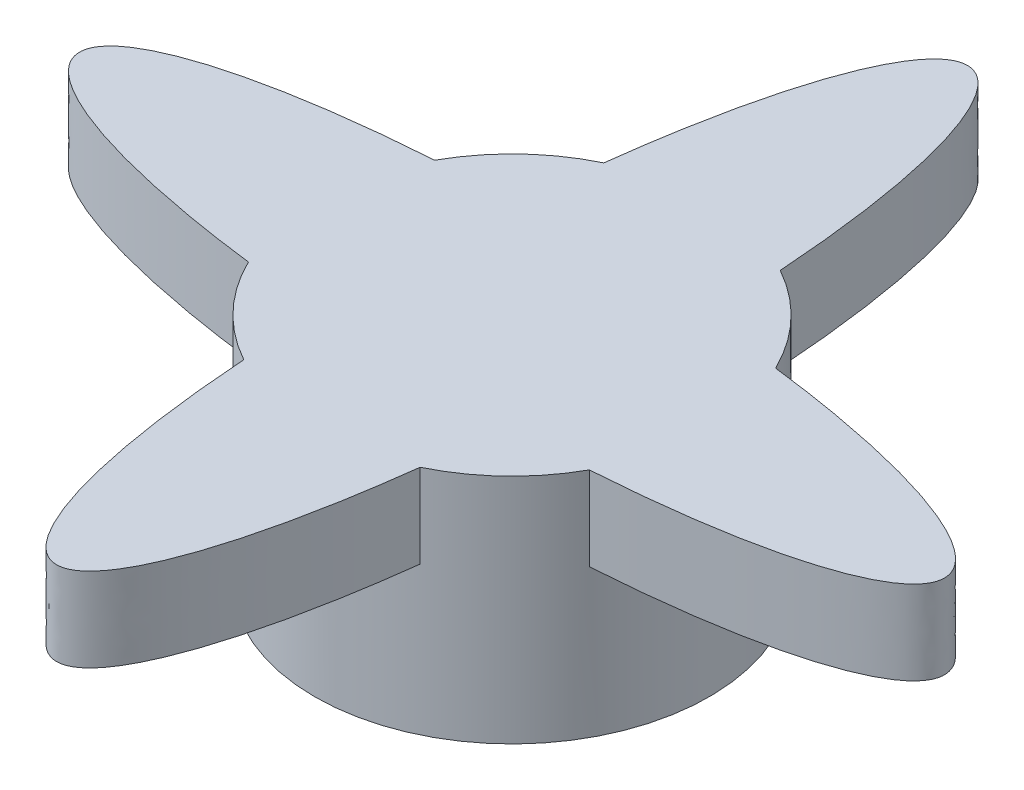
from build123d import *

# Parameters (mm, degrees)
SKETCH_1_R      = 4
SKETCH_1_R_2    = 2.5
EXTRUDE_1_DEPTH = 3
SKETCH_2_R      = 4
EXTRUDE_2_DEPTH = 1.7


with BuildPart() as part:
    # 草图1 → 凸台-拉伸1 (new body)
    with BuildSketch(Plane(origin=(0, 0, 0), x_dir=(1, 0, 0), z_dir=(0, 1, 0))):
        with Locations(Location((0, 0, 0), (0, 0, 270))):
            Circle(SKETCH_1_R)
        with Locations(Location((0, 0, 0), (0, 0, 270))):
            Circle(SKETCH_1_R_2, mode=Mode.SUBTRACT)
    extrude(amount=EXTRUDE_1_DEPTH)

    # 草图2 → 凸台-拉伸2 (add)
    with BuildSketch(Plane(origin=(0, 3, 0), x_dir=(1, 0, 0), z_dir=(0, 1, 0))):
        with BuildLine():
            ThreePointArc((3.601811154, 1.73981505), (3.899182261, 0.892399962), (4, 0))
            ThreePointArc((4, 0), (3.873348744, -0.998583752), (3.501415245, -1.933931561))
            add(Edge.make_bspline(
                [(3.501415245, -1.933931561), (22.78951803, -0.622790472), (3.601811154, 1.73981505)],
                knots=[1.976614939, 1.976614939, 1.976614939, 4.306570368, 4.306570368, 4.306570368], degree=2, weights=[1, 0.394771017, 1]))
        make_face()
        with BuildLine():
            ThreePointArc((-1.73981505, 3.601811154), (0.109270946, 3.998507204), (1.933931561, 3.501415245))
            add(Edge.make_bspline(
                [(1.933931561, 3.501415245), (0.622790472, 22.78951803), (-1.73981505, 3.601811154)],
                knots=[5.118207593, 5.118207593, 5.118207593, 7.448163021, 7.448163021, 7.448163021], degree=2, weights=[1, 0.394771017, 1]))
        make_face()
        with BuildLine():
            ThreePointArc((-3.601811154, -1.73981505), (-3.998507204, 0.109270946), (-3.501415245, 1.933931561))
            add(Edge.make_bspline(
                [(-3.501415245, 1.933931561), (-22.78951803, 0.622790472), (-3.601811154, -1.73981505)],
                knots=[5.118207593, 5.118207593, 5.118207593, 7.448163021, 7.448163021, 7.448163021], degree=2, weights=[1, 0.394771017, 1]))
        make_face()
        with BuildLine():
            add(Edge.make_bspline(
                [(-1.933931561, -3.501415245), (-0.622790472, -22.78951803), (1.73981505, -3.601811154)],
                knots=[1.976614939, 1.976614939, 1.976614939, 4.306570368, 4.306570368, 4.306570368], degree=2, weights=[1, 0.394771017, 1]))
            ThreePointArc((1.73981505, -3.601811154), (-0.109270946, -3.998507204), (-1.933931561, -3.501415245))
        make_face()
        with Locations(Location((0, 0, 0), (0, 0, 115.782351759))):
            Circle(SKETCH_2_R)
    extrude(amount=EXTRUDE_2_DEPTH)


solid = part.part
